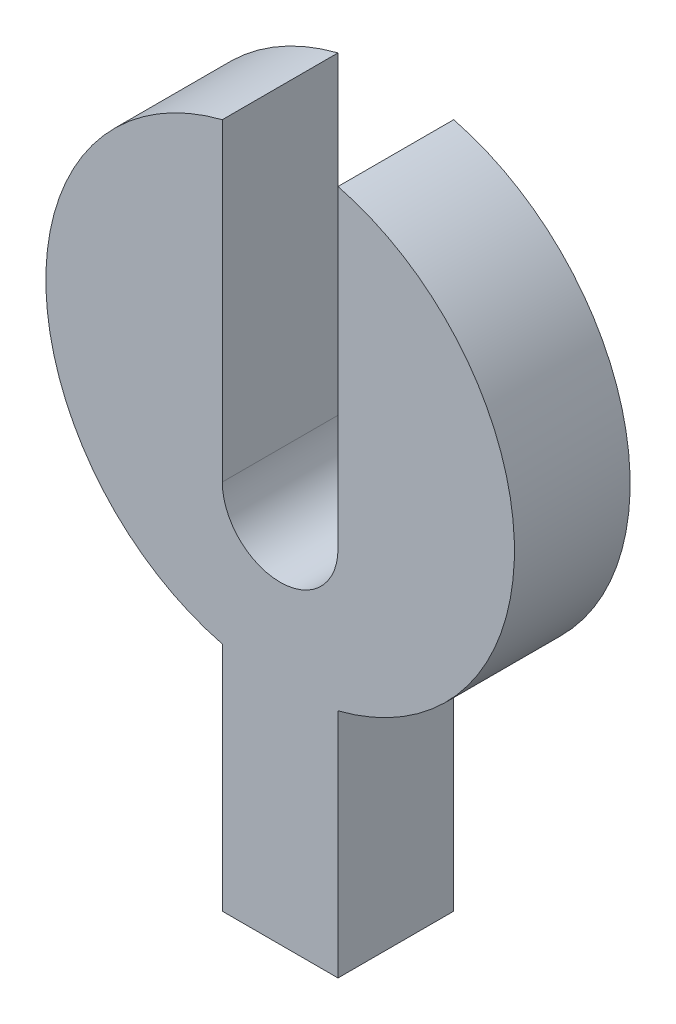
from build123d import *

# Parameters (mm, degrees)
ESQUISSE1_W        = 4
ESQUISSE1_H        = 8
BOSS_EXTRU_1_DEPTH = 4


with BuildPart() as part:
    # Esquisse1 → Boss.-Extru.1 (new body)
    with BuildSketch(Plane.XY):
        with BuildLine():
            Line((-2, 7.849203781), (-2, -3))
            ThreePointArc((-2, -3), (0, -5), (2, -3))
            Line((2, -3), (2, 7.849203781))
            ThreePointArc((2, 7.849203781), (0, -8.1), (-2, 7.849203781))
        make_face()
        with Locations((0, -11.849203781)):
            Rectangle(ESQUISSE1_W, ESQUISSE1_H)
    extrude(amount=BOSS_EXTRU_1_DEPTH)


solid = part.part
